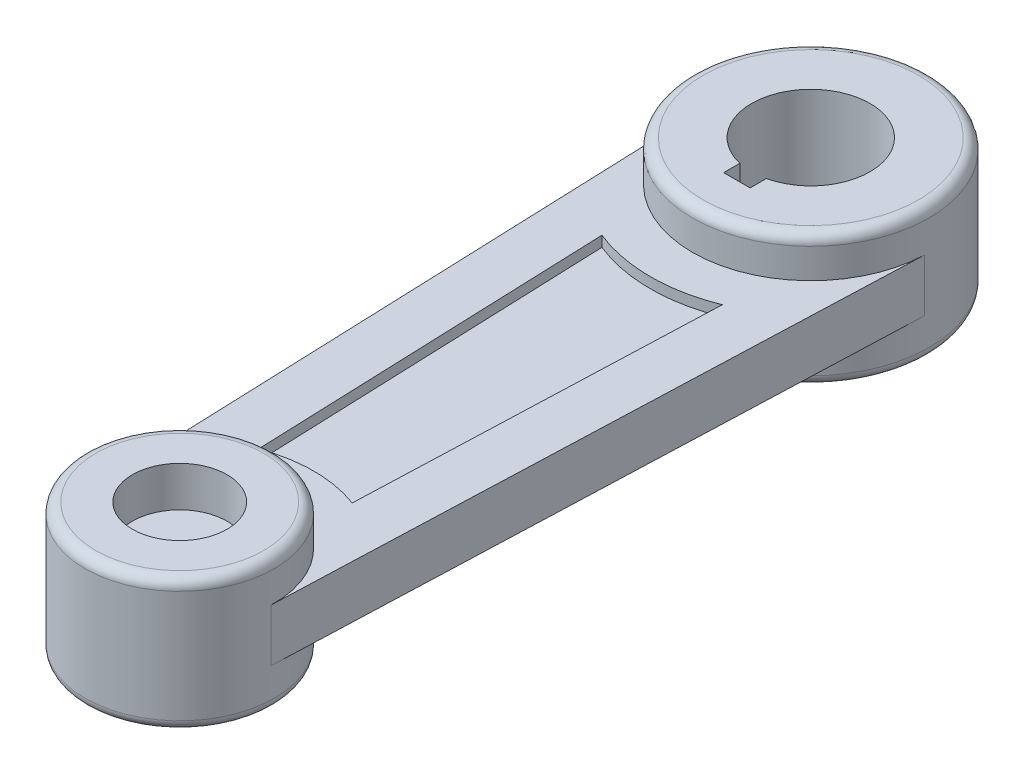
from build123d import *

# Parameters (mm, degrees)
SKETCH1_R             = 45
SKETCH1_R_2           = 22.5
BOSS_EXTRUDE1_DEPTH   = 31.65
SKETCH1_R_3           = 56.25
SKETCH1_R_4           = 28.15
BOSS_EXTRUDE1_2_DEPTH = 31.65
BOSS_EXTRUDE2_DEPTH   = 12.5
CUT_EXTRUDE1_DEPTH    = 5
CUT_EXTRUDE2_DEPTH    = 367.176207583
FILLET1_R             = 5


with BuildPart() as part:
    # Sketch1 → Boss-Extrude1 (new, symmetric)
    with BuildSketch(Plane(origin=(0, 0, 0), x_dir=(1, 0, 0), z_dir=(0, 1, 0))):
        with Locations(Location((0, 0, 0), (0, 0, 270))):
            Circle(SKETCH1_R)
        with Locations(Location((0, 0, 0), (0, 0, 270))):
            Circle(SKETCH1_R_2, mode=Mode.SUBTRACT)
    extrude(amount=BOSS_EXTRUDE1_DEPTH, both=True)



with BuildPart() as body_2:
    # Sketch1 → Boss-Extrude1 2 (new, symmetric)
    with BuildSketch(Plane(origin=(0, 0, 0), x_dir=(1, 0, 0), z_dir=(0, 1, 0))):
        with Locations(Location((0, 300, 0), (0, 0, 270))):
            Circle(SKETCH1_R_3)
        with Locations(Location((0, 300, 0), (0, 0, 270))):
            Circle(SKETCH1_R_4, mode=Mode.SUBTRACT)
    extrude(amount=BOSS_EXTRUDE1_2_DEPTH, both=True)


with BuildPart() as part_1:
    add(part.part)

    add(body_2.part)  # Boss-Extrude2 merges body 2
    # Sketch2 → Boss-Extrude2 (add, symmetric)
    with BuildSketch(Plane(origin=(0, 0, 0), x_dir=(1, 0, 0), z_dir=(0, 1, 0))):
        with BuildLine():
            Line((56.210435304, 297.890625), (44.968348244, -1.6875))
            ThreePointArc((44.968348244, -1.6875), (0, -45), (-44.968348244, -1.6875))
            Line((-44.968348244, -1.6875), (-56.210435304, 297.890625))
            ThreePointArc((-56.210435304, 297.890625), (0, 356.25), (56.210435304, 297.890625))
        make_face()
    extrude(amount=BOSS_EXTRUDE2_DEPTH, both=True)

    # Sketch3 → Cut-Extrude1 (cut)
    with BuildSketch(Plane(origin=(0, 12.5, 0), x_dir=(1, 0, 0), z_dir=(0, 1, 0))):
        with BuildLine():
            Line((22.255863805, 59.73892388), (28.619814412, 229.324907336))
            ThreePointArc((28.619814412, 229.324907336), (0, 223.75), (-28.619814412, 229.324907336))
            Line((-28.619814412, 229.324907336), (-22.255863805, 59.73892388))
            ThreePointArc((-22.255863805, 59.73892388), (0, 63.75), (22.255863805, 59.73892388))
        make_face()
    cut_extrude1 = extrude(amount=-CUT_EXTRUDE1_DEPTH, mode=Mode.SUBTRACT)

    # Mirror1: Cut-Extrude1 across plane
    add(cut_extrude1.mirror(Plane.ZX), mode=Mode.SUBTRACT)

    # Sketch4 → Cut-Extrude2 (cut, through all)
    with BuildSketch(Plane(origin=(0, 31.65, 0), x_dir=(1, 0, 0), z_dir=(0, 1, 0))):
        with BuildLine():
            Line((6.3, 272.564029086), (6.3, 264.864029086))
            Line((6.3, 264.864029086), (-6.3, 264.864029086))
            Line((-6.3, 264.864029086), (-6.3, 272.564029086))
            ThreePointArc((-6.3, 272.564029086), (0, 328.15), (6.3, 272.564029086))
        make_face()
    extrude(amount=-CUT_EXTRUDE2_DEPTH, mode=Mode.SUBTRACT)

    # Fillet1
    fillet1_edges = [part_1.edges().sort_by_distance(p)[0] for p in [
        (0, -31.65, -45),
        (0, -31.65, -356.25),
        (0, 31.65, -356.25),
        (0, 31.65, -45),
    ]]
    fillet(fillet1_edges, radius=FILLET1_R)


solid = part_1.part
